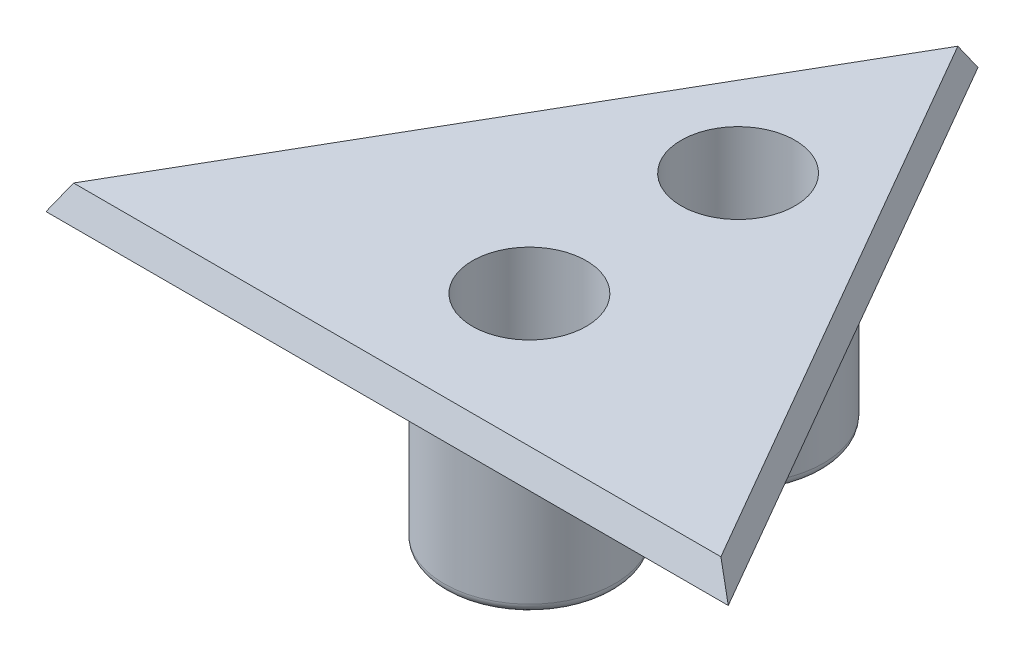
from build123d import *

# Parameters (mm, degrees)
BOSS_EXTRUDE1_DEPTH    = 3
BOSS_EXTRUDE1_TAPER    = 19.5
BOSS_EXTRUDE2_START    = -3
SKETCH3_R              = 9
BOSS_EXTRUDE2_DEPTH    = 20
SKETCH4_R              = 6
CUT_EXTRUDE1_DEPTH     = 10
M12_TAPPED_HOLE1_D     = 10.2
FILLET1_R              = 1
FILLET2_R              = 0.5
LPATTERN1_COUNT        = 2
LPATTERN1_PITCH        = 22
FILLET1_OF_LPATTERN1_R = 1
FILLET2_OF_LPATTERN1_R = 0.5


with BuildPart() as part:
    # Sketch1 → Boss-Extrude1 (new body)
    with BuildSketch(Plane(origin=(0, 0, 0), x_dir=(1, 0, 0), z_dir=(0, 1, 0))):
        Polygon((0, 41.528227513), (-35.9645, -20.764113756), (35.9645, -20.764113756), align=None)
    extrude(amount=BOSS_EXTRUDE1_DEPTH, taper=BOSS_EXTRUDE1_TAPER)

    # Sketch3 → Boss-Extrude2 (add)
    with BuildSketch(Plane(origin=(0, 3, 0), x_dir=(1, 0, 0), z_dir=(0, 1, 0)).offset(BOSS_EXTRUDE2_START)):
        with Locations(Location((0, 16.235886244, 0), (0, 0, 270))):
            Circle(SKETCH3_R)
    boss_extrude2 = extrude(amount=-BOSS_EXTRUDE2_DEPTH)

    # Sketch4 → Cut-Extrude1 (cut)
    with BuildSketch(Plane(origin=(0, 3, 0), x_dir=(1, 0, 0), z_dir=(0, 1, 0))):
        with Locations(Location((0, 16.235886244, 0), (0, 0, 270))):
            Circle(SKETCH4_R)
    cut_extrude1 = extrude(amount=-CUT_EXTRUDE1_DEPTH, mode=Mode.SUBTRACT)

    # M12 Tapped Hole1 (through all)
    with Locations(Plane(origin=(0, -20, 0), x_dir=(-1, 0, 0), z_dir=(0, -1, 0))):
        with Locations((0, 16.235886244)):
            m12_tapped_hole1 = Hole(M12_TAPPED_HOLE1_D / 2)

    # Fillet1
    fillet1_edges = [part.edges().sort_by_distance(p)[0] for p in [
        (0, -20, -25.235886244),
    ]]
    fillet(fillet1_edges, radius=FILLET1_R)

    # Fillet2
    fillet2_edges = [part.edges().sort_by_distance(p)[0] for p in [
        (0, 0, -25.235886244),
    ]]
    fillet(fillet2_edges, radius=FILLET2_R)

    # LPattern1: Boss-Extrude2, Cut-Extrude1, M12 Tapped Hole1 ×2
    with Locations(*[(0, 0, i * LPATTERN1_PITCH) for i in range(1, LPATTERN1_COUNT)]):
        add(boss_extrude2)
        add(cut_extrude1, mode=Mode.SUBTRACT)
        add(m12_tapped_hole1, mode=Mode.SUBTRACT)

    # Fillet1 of LPattern1
    fillet1_of_lpattern1_edges = [part.edges().sort_by_distance(p)[0] for p in [
        (0, -20, -3.235886244),
    ]]
    fillet(fillet1_of_lpattern1_edges, radius=FILLET1_OF_LPATTERN1_R)

    # Fillet2 of LPattern1
    fillet2_of_lpattern1_edges = [part.edges().sort_by_distance(p)[0] for p in [
        (0, 0, -3.235886244),
    ]]
    fillet(fillet2_of_lpattern1_edges, radius=FILLET2_OF_LPATTERN1_R)


solid = part.part
